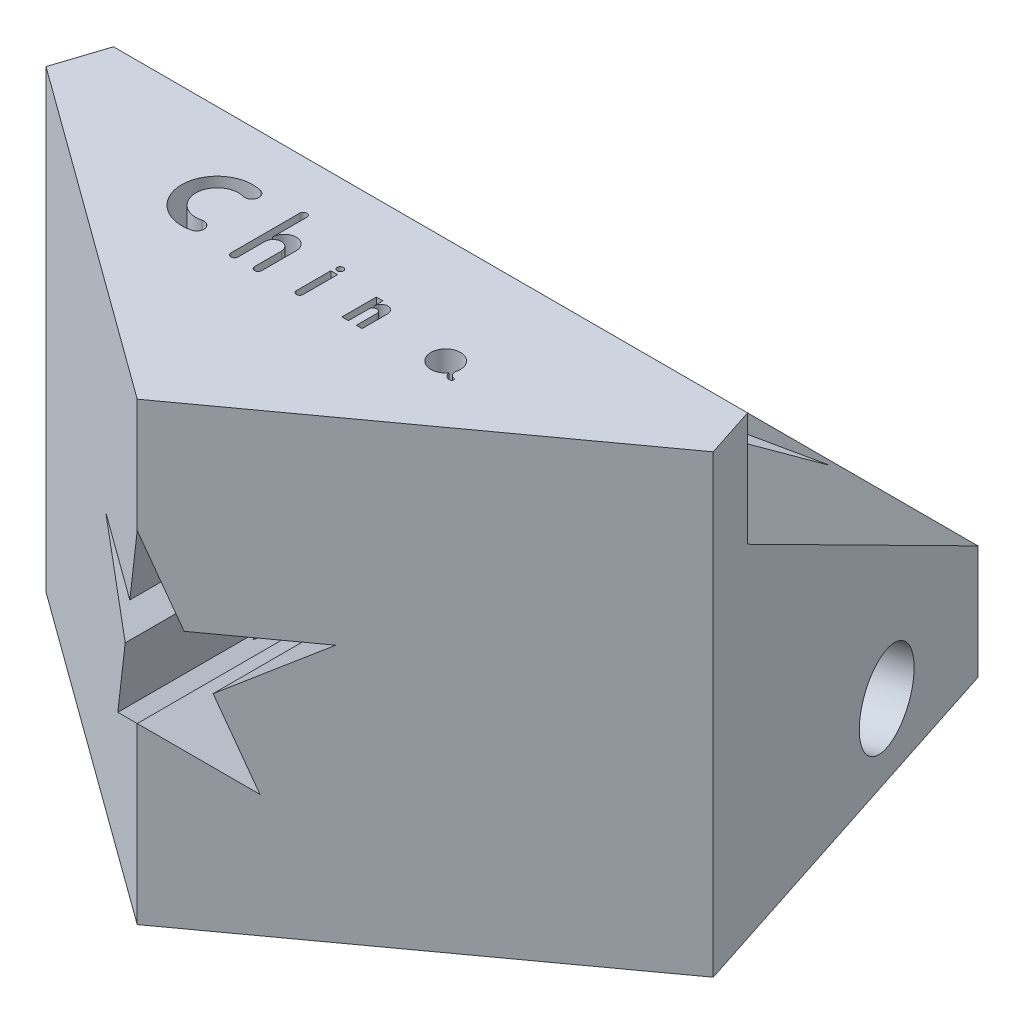
from build123d import *

# Parameters (mm, degrees)
EXTRUDE_1_DEPTH          = 16
CUT_EXTRUDE_1_DEPTH      = 42.30909883
CUT_EXTRUDE_1_DEPTH_BACK = 42.30909883
SKETCH_4_R               = 3
CUT_EXTRUDE_2_DEPTH      = 23
CUT_EXTRUDE_3_DEPTH      = 42.30909883
CUT_EXTRUDE_3_DEPTH_BACK = 42.30909883
SKETCH_8_R               = 0.219313102
CUT_EXTRUDE_4_DEPTH      = 50.743759871


with BuildPart() as part:
    # 草图1 → 凸台-拉伸1 (new, symmetric)
    with BuildSketch(Plane(origin=(0, 0, 0), x_dir=(1, 0, 0), z_dir=(0, 1, 0))):
        Polygon((-14.5, 30), (14.5, 30), (23.461492837, 2.419361027), (0, -14.626411289), (-23.461492837, 2.419361027), align=None)
    extrude(amount=EXTRUDE_1_DEPTH, both=True)

    # 草图3 → 切除-拉伸1 (cut, two sides: drawn at the far end of the back side and taken through both)
    with BuildSketch(Plane(origin=(0, 0, 0), x_dir=(0, 0, -1), z_dir=(1, 0, 0)).offset(-CUT_EXTRUDE_1_DEPTH_BACK)):
        Polygon((6, 16), (6, 8), (30, -8), (30, 16), align=None)
    extrude(amount=CUT_EXTRUDE_1_DEPTH + CUT_EXTRUDE_1_DEPTH_BACK, mode=Mode.SUBTRACT)

    # 草图4 → 切除-拉伸2 (cut)
    with BuildSketch(Plane(origin=(21.932151994, 0, -7.126188163), x_dir=(-0.3090169943749527, 0, -0.9510565162951519), z_dir=(0.951056516295152, 0, -0.3090169943749527))):
        with Locations((14.05094907, -11)):
            Circle(SKETCH_4_R)
    cut_extrude_2 = extrude(amount=-CUT_EXTRUDE_2_DEPTH, mode=Mode.SUBTRACT)

    # 镜向1: 切除-拉伸2 across plane
    add(cut_extrude_2.mirror(Plane(origin=(0, 0, 0), x_dir=(0, 0, 1), z_dir=(1, 0, 0))), mode=Mode.SUBTRACT)

    # 草图7 → 切除-拉伸3 (cut, two sides: drawn at the far end of the back side and taken through both)
    with BuildSketch(Plane.XY.offset(-CUT_EXTRUDE_3_DEPTH_BACK)):
        Polygon((0, 8), (-1.909830056, 2.122147477), (-8.090169944, 2.122147477), (-3.090169944, -1.510565163), (-5, -7.388417686), (0, -3.755705046), (5, -7.388417686), (3.090169944, -1.510565163), (8.090169944, 2.122147477), (1.909830056, 2.122147477), align=None)
    extrude(amount=CUT_EXTRUDE_3_DEPTH + CUT_EXTRUDE_3_DEPTH_BACK, mode=Mode.SUBTRACT)

    # 草图8 → 切除-拉伸4 (cut, through all)
    with BuildSketch(Plane(origin=(0, 16, 0), x_dir=(1, 0, 0), z_dir=(0, 1, 0))):
        with Locations(Location((-0.775935465, 0.431354415, 0), (0, 0, 270))):
            Circle(SKETCH_8_R)
        with BuildLine():
            Line((-5.113847326, 2.420614591), (-5.113847326, 0))
            ThreePointArc((-5.113847326, 0), (-4.281010431, 0.832836895), (-3.448173537, 0))
            Line((-3.448173537, 0), (-3.448173537, -2.420614591))
            ThreePointArc((-3.448173537, -2.420614591), (-3.698173537, -2.670614591), (-3.948173537, -2.420614591))
            Line((-3.948173537, -2.420614591), (-3.948173537, -0.536873711))
            ThreePointArc((-3.948173537, -0.536873711), (-4.531010431, 0.045963183), (-5.113847326, -0.536873711))
            Line((-5.113847326, -0.536873711), (-5.113847326, -2.420614591))
            ThreePointArc((-5.113847326, -2.420614591), (-5.363847326, -2.670614591), (-5.613847326, -2.420614591))
            Line((-5.613847326, -2.420614591), (-5.613847326, 2.420614591))
            ThreePointArc((-5.613847326, 2.420614591), (-5.363847326, 2.670614591), (-5.113847326, 2.420614591))
        make_face()
        with BuildLine():
            Line((-1.013410033, 0), (-1.013410033, -2.420614591))
            ThreePointArc((-1.013410033, -2.420614591), (-0.775935465, -2.658089159), (-0.538460898, -2.420614591))
            Line((-0.538460898, -2.420614591), (-0.538460898, 0))
            Line((-0.538460898, 0), (-1.013410033, 0))
        make_face()
        with BuildLine():
            Line((2.187750175, 0), (2.187750175, -2.420614591))
            Line((2.187750175, -2.420614591), (2.64847422, -2.420614591))
            Line((2.64847422, -2.420614591), (2.64847422, -0.984785713))
            ThreePointArc((2.64847422, -0.984785713), (2.926986903, -0.70627303), (3.205499587, -0.984785713))
            Line((3.205499587, -0.984785713), (3.205499587, -2.420614591))
            Line((3.205499587, -2.420614591), (3.610975114, -2.420614591))
            Line((3.610975114, -2.420614591), (3.610975114, -0.622613397))
            ThreePointArc((3.610975114, -0.622613397), (3.129724667, -0.14136295), (2.64847422, -0.622613397))
            Line((2.64847422, -0.622613397), (2.64847422, 0))
            Line((2.64847422, 0), (2.187750175, 0))
        make_face()
        with BuildLine():
            ThreePointArc((-8.375, 2.420614591), (-11.5, 0), (-8.375, -2.420614591))
            ThreePointArc((-8.375, -2.420614591), (-8.015877082, -1.811491673), (-8.625, -1.452368755))
            ThreePointArc((-8.625, -1.452368755), (-10.5, 0), (-8.625, 1.452368755))
            ThreePointArc((-8.625, 1.452368755), (-8.015877082, 1.811491673), (-8.375, 2.420614591))
        make_face()
        with BuildLine():
            ThreePointArc((9.512511285, -1.753375111), (7.583787314, -0.99482991), (9.364950424, -2.05446426))
            ThreePointArc((9.364950424, -2.05446426), (9.507618037, -2.354597316), (9.820725394, -2.465942199))
            ThreePointArc((9.820725394, -2.465942199), (9.943547456, -2.381589693), (9.923856182, -2.233897927))
            ThreePointArc((9.923856182, -2.233897927), (9.6186642, -2.078828836), (9.512511285, -1.753375111))
        make_face()
    extrude(amount=-CUT_EXTRUDE_4_DEPTH, mode=Mode.SUBTRACT)


solid = part.part
